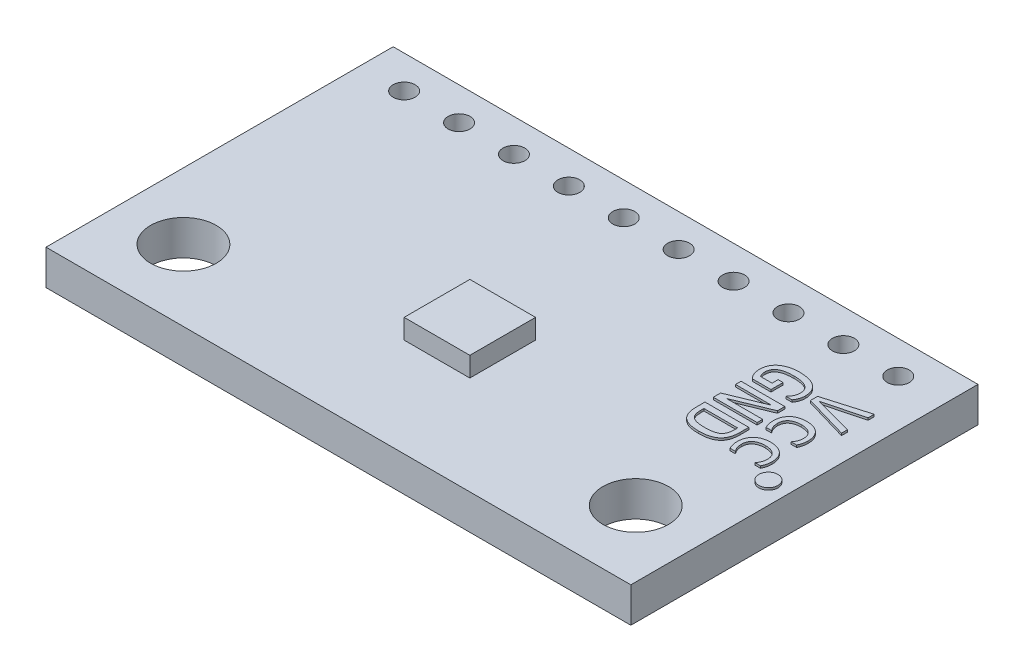
from build123d import *

# Parameters (mm, degrees)
SKETCH1_W                = 26.7
SKETCH1_H                = 15.85
FR4_BOARD_DEPTH          = 1.6
SKETCH2_W                = 3
SKETCH2_H                = 3
QFN_CHIP_DEPTH           = 0.9
SKETCH4_R                = 0.5
HEADER_CONNECTIONS_DEPTH = 16.725079491
SKETCH5_R                = 1.5
HOLES_MOUNTING_DEPTH     = 16.725079491
SKETCH6_R                = 0.436089782
BOSS_EXTRUDE1_DEPTH      = 0.1


with BuildPart() as part:
    # Sketch1 → FR4-board (new body)
    with BuildSketch(Plane(origin=(0, 0, 0), x_dir=(1, 0, 0), z_dir=(0, 1, 0))):
        Rectangle(SKETCH1_W, SKETCH1_H)
    extrude(amount=FR4_BOARD_DEPTH)

    # Sketch4 → header-connections (cut, through all)
    with BuildSketch(Plane(origin=(0, 0, 0), x_dir=(1, 0, 0), z_dir=(0, 1, 0))):
        with Locations(Location((-11.35, 6.425, 0), (0, 0, 270))):
            Circle(SKETCH4_R)
        with Locations(Location((-8.843333333, 6.425, 0), (0, 0, 270))):
            Circle(SKETCH4_R)
        with Locations(Location((-6.336666667, 6.425, 0), (0, 0, 270))):
            Circle(SKETCH4_R)
        with Locations(Location((-3.83, 6.425, 0), (0, 0, 270))):
            Circle(SKETCH4_R)
        with Locations(Location((-1.323333333, 6.425, 0), (0, 0, 270))):
            Circle(SKETCH4_R)
        with Locations(Location((1.183333333, 6.425, 0), (0, 0, 270))):
            Circle(SKETCH4_R)
        with Locations(Location((3.69, 6.425, 0), (0, 0, 270))):
            Circle(SKETCH4_R)
        with Locations(Location((6.196666667, 6.425, 0), (0, 0, 270))):
            Circle(SKETCH4_R)
        with Locations(Location((8.703333333, 6.425, 0), (0, 0, 270))):
            Circle(SKETCH4_R)
        with Locations(Location((11.21, 6.425, 0), (0, 0, 270))):
            Circle(SKETCH4_R)
    extrude(amount=HEADER_CONNECTIONS_DEPTH, mode=Mode.SUBTRACT)

    # Sketch5 → holes-mounting (cut, through all)
    with BuildSketch(Plane(origin=(0, 0, 0), x_dir=(1, 0, 0), z_dir=(0, 1, 0))):
        with Locations(Location((-10.325, -4.675, 0), (0, 0, 270))):
            Circle(SKETCH5_R)
        with Locations(Location((10.325, -4.675, 0), (0, 0, 90))):
            Circle(SKETCH5_R)
    extrude(amount=HOLES_MOUNTING_DEPTH, mode=Mode.SUBTRACT)

    # Sketch6 → Boss-Extrude1 (add)
    # profile 1 of 7: a face of its own
    with BuildSketch(Plane(origin=(0, 1.6, 0), x_dir=(1, 0, 0), z_dir=(0, 1, 0))):
        with Locations(Location((12.442186595, -0.735901507, 0), (0, 0, 270))):
            Circle(SKETCH6_R)
    # profile 2 of 7: a face of its own
    with BuildSketch(Plane(origin=(0, 1.6, 0), x_dir=(1, 0, 0), z_dir=(0, 1, 0))):
        Polygon((10.490449207, 3.528442684), (12.262601106, 3.059692684), (12.262601106, 2.780816102), (10.262601106, 3.364281291), (10.262601106, 3.691021798), (12.262601106, 4.274486988), (12.262601106, 3.995610405), align=None)
    # profile 3 of 7: a face of its own
    with BuildSketch(Plane(origin=(0, 1.6, 0), x_dir=(1, 0, 0), z_dir=(0, 1, 0))):
        with BuildLine():
            add(Edge.make_bspline(
                [(10.313234017, 1.287145215), (10.305112133, 1.30379608), (10.288947795, 1.33693497), (10.268576769, 1.388025137), (10.251000839, 1.439614148), (10.236760985, 1.491934519), (10.225646643, 1.545034576), (10.217809823, 1.598801119), (10.212862075, 1.653217788), (10.212267254, 1.689692734), (10.211968194, 1.708031291)],
                knots=[0, 0, 0, 0, 1.017318466, 2.024687874, 3.018716136, 4.009678849, 5.00117078, 5.996780967, 6.992838908, 8, 8, 8, 8], degree=3))
            add(Edge.make_bspline(
                [(10.211968194, 1.708031291), (10.21251301, 1.736410863), (10.21357576, 1.791769795), (10.223668945, 1.872415844), (10.240112487, 1.948370308), (10.263465919, 2.019434974), (10.293361241, 2.08577466), (10.329705343, 2.147427502), (10.373423175, 2.203876474), (10.422776044, 2.255845904), (10.478268449, 2.302136298), (10.539156063, 2.342381537), (10.605446355, 2.375887619), (10.676252131, 2.404254818), (10.75259147, 2.425410403), (10.833687105, 2.440757754), (10.919961275, 2.449898847), (10.979087323, 2.451090504), (11.009436549, 2.451702177)],
                knots=[0, 0, 0, 0, 1.101009695, 2.147696959, 3.148479169, 4.112976319, 5.045150305, 5.967552687, 6.883630536, 7.810239423, 8.743929232, 9.682109944, 10.636494221, 11.621942462, 12.63768542, 13.705575071, 14.822278422, 16, 16, 16, 16], degree=3))
            add(Edge.make_bspline(
                [(11.009436549, 2.451702177), (11.039785775, 2.451090504), (11.098911822, 2.449898847), (11.185185993, 2.440757754), (11.266281628, 2.425410403), (11.342620967, 2.404254818), (11.413426743, 2.375887619), (11.479717035, 2.342381537), (11.540604649, 2.302136298), (11.596097053, 2.255845904), (11.645449922, 2.203876474), (11.689167755, 2.147427502), (11.725511857, 2.08577466), (11.755407178, 2.019434974), (11.778760611, 1.948370308), (11.795204153, 1.872415844), (11.805297338, 1.791769795), (11.806360088, 1.736410863), (11.806904903, 1.708031291)],
                knots=[0, 0, 0, 0, 1.177721578, 2.294424929, 3.36231458, 4.378057538, 5.363505779, 6.317890056, 7.256070768, 8.189760577, 9.116369464, 10.032447313, 10.954849695, 11.887023681, 12.851520831, 13.852303041, 14.898990305, 16, 16, 16, 16], degree=3))
            add(Edge.make_bspline(
                [(11.806904903, 1.708031291), (11.806616762, 1.68995462), (11.806043687, 1.654002554), (11.800949129, 1.600549341), (11.793748621, 1.547626205), (11.782324194, 1.495435941), (11.768581001, 1.44317394), (11.751098199, 1.391005396), (11.730137752, 1.338737696), (11.713865088, 1.30446861), (11.705639081, 1.287145215)],
                knots=[0, 0, 0, 0, 0.992934621, 1.974813259, 2.948128798, 3.925694997, 4.90802788, 5.916044588, 6.946537941, 8, 8, 8, 8], degree=3))
            Line((11.705639081, 1.287145215), (11.452474524, 1.287145215))
            add(Edge.make_bspline(
                [(11.452474524, 1.287145215), (11.465123167, 1.303443423), (11.489885856, 1.335350993), (11.521809393, 1.385078866), (11.548351079, 1.434887316), (11.569107558, 1.485413828), (11.585358841, 1.537641458), (11.596103252, 1.592826948), (11.603021003, 1.651157647), (11.603915486, 1.691133089), (11.604373258, 1.711591418)],
                knots=[0, 0, 0, 0, 1.074217982, 2.103033978, 3.073910332, 4.010130881, 4.94433371, 5.918217984, 6.934601329, 8, 8, 8, 8], degree=3))
            add(Edge.make_bspline(
                [(11.604373258, 1.711591418), (11.603932837, 1.730598903), (11.60307623, 1.767568018), (11.595983693, 1.821442687), (11.583488118, 1.871814613), (11.567298159, 1.919222887), (11.545064161, 1.962727572), (11.518478065, 2.003132543), (11.486627582, 2.039854938), (11.450375121, 2.073429211), (11.409500517, 2.10295638), (11.364645445, 2.12887694), (11.315402654, 2.15012958), (11.262248448, 2.168013693), (11.204768163, 2.181693067), (11.143280918, 2.191464134), (11.077726763, 2.197494887), (11.032656723, 2.198183068), (11.009436549, 2.198537621)],
                knots=[0, 0, 0, 0, 1.044179997, 2.030905749, 2.978030625, 3.892303705, 4.776842266, 5.654948601, 6.543719924, 7.440955367, 8.36405586, 9.308516838, 10.281744973, 11.305850765, 12.386540981, 13.524023351, 14.72437194, 16, 16, 16, 16], degree=3))
            add(Edge.make_bspline(
                [(11.009436549, 2.198537621), (10.986348492, 2.19817763), (10.941410845, 2.197476959), (10.8761162, 2.191496668), (10.814761771, 2.181667015), (10.757451486, 2.167939204), (10.704033725, 2.150367436), (10.655159323, 2.127781903), (10.60977457, 2.102377611), (10.56892581, 2.072452484), (10.532215135, 2.039347862), (10.500852366, 2.002177051), (10.474135081, 1.961975707), (10.452178769, 1.918437295), (10.435179457, 1.871409576), (10.422942092, 1.821027871), (10.415800381, 1.767308619), (10.414940466, 1.730468537), (10.41449984, 1.711591418)],
                knots=[0, 0, 0, 0, 1.269431353, 2.470769189, 3.602031163, 4.683612011, 5.708561801, 6.68851158, 7.640043068, 8.563904318, 9.467220602, 10.352012893, 11.230842903, 12.116110441, 13.026759688, 13.974665121, 14.962204065, 16, 16, 16, 16], degree=3))
            add(Edge.make_bspline(
                [(10.41449984, 1.711591418), (10.414972203, 1.690477075), (10.415895791, 1.64919322), (10.422609913, 1.588958634), (10.434020455, 1.531999468), (10.450357394, 1.478237275), (10.471378113, 1.426924696), (10.498252765, 1.378316266), (10.529501008, 1.331111603), (10.553972466, 1.301951913), (10.566398574, 1.287145215)],
                knots=[0, 0, 0, 0, 1.097451232, 2.145793411, 3.14590378, 4.112960838, 5.062540776, 6.022576656, 6.995904645, 8, 8, 8, 8], degree=3))
            Line((10.566398574, 1.287145215), (10.313234017, 1.287145215))
        make_face()
    # profile 4 of 7: a face of its own
    with BuildSketch(Plane(origin=(0, 1.6, 0), x_dir=(1, 0, 0), z_dir=(0, 1, 0))):
        with BuildLine():
            add(Edge.make_bspline(
                [(10.313234017, -0.358424405), (10.305112133, -0.34177354), (10.288947795, -0.308634651), (10.268576769, -0.257544483), (10.251000839, -0.205955472), (10.236760985, -0.153635101), (10.225646643, -0.100535044), (10.217809823, -0.046768501), (10.212862075, 0.007648168), (10.212267254, 0.044123114), (10.211968194, 0.062461671)],
                knots=[0, 0, 0, 0, 1.017318466, 2.024687874, 3.018716136, 4.009678849, 5.00117078, 5.996780967, 6.992838908, 8, 8, 8, 8], degree=3))
            add(Edge.make_bspline(
                [(10.211968194, 0.062461671), (10.21251301, 0.090841243), (10.21357576, 0.146200175), (10.223668945, 0.226846224), (10.240112487, 0.302800688), (10.263465919, 0.373865354), (10.293361241, 0.44020504), (10.329705343, 0.501857882), (10.373423175, 0.558306854), (10.422776044, 0.610276283), (10.478268449, 0.656566678), (10.539156063, 0.696811917), (10.605446355, 0.730317999), (10.676252131, 0.758685198), (10.75259147, 0.779840783), (10.833687105, 0.795188134), (10.919961275, 0.804329226), (10.979087323, 0.805520883), (11.009436549, 0.806132557)],
                knots=[0, 0, 0, 0, 1.101009695, 2.147696959, 3.148479169, 4.112976319, 5.045150305, 5.967552687, 6.883630536, 7.810239423, 8.743929232, 9.682109944, 10.636494221, 11.621942462, 12.63768542, 13.705575071, 14.822278422, 16, 16, 16, 16], degree=3))
            add(Edge.make_bspline(
                [(11.009436549, 0.806132557), (11.039785775, 0.805520883), (11.098911822, 0.804329226), (11.185185993, 0.795188134), (11.266281628, 0.779840783), (11.342620967, 0.758685198), (11.413426743, 0.730317999), (11.479717035, 0.696811917), (11.540604649, 0.656566678), (11.596097053, 0.610276283), (11.645449922, 0.558306854), (11.689167755, 0.501857882), (11.725511857, 0.44020504), (11.755407178, 0.373865354), (11.778760611, 0.302800688), (11.795204153, 0.226846224), (11.805297338, 0.146200175), (11.806360088, 0.090841243), (11.806904903, 0.062461671)],
                knots=[0, 0, 0, 0, 1.177721578, 2.294424929, 3.36231458, 4.378057538, 5.363505779, 6.317890056, 7.256070768, 8.189760577, 9.116369464, 10.032447313, 10.954849695, 11.887023681, 12.851520831, 13.852303041, 14.898990305, 16, 16, 16, 16], degree=3))
            add(Edge.make_bspline(
                [(11.806904903, 0.062461671), (11.806616762, 0.044385), (11.806043687, 0.008432934), (11.800949129, -0.045020279), (11.793748621, -0.097943415), (11.782324194, -0.150133679), (11.768581001, -0.202395681), (11.751098199, -0.254564224), (11.730137752, -0.306831924), (11.713865088, -0.34110101), (11.705639081, -0.358424405)],
                knots=[0, 0, 0, 0, 0.992934621, 1.974813259, 2.948128798, 3.925694997, 4.90802788, 5.916044588, 6.946537941, 8, 8, 8, 8], degree=3))
            Line((11.705639081, -0.358424405), (11.452474524, -0.358424405))
            add(Edge.make_bspline(
                [(11.452474524, -0.358424405), (11.465123167, -0.342126197), (11.489885856, -0.310218627), (11.521809393, -0.260490754), (11.548351079, -0.210682304), (11.569107558, -0.160155792), (11.585358841, -0.107928162), (11.596103252, -0.052742673), (11.603021003, 0.005588027), (11.603915486, 0.045563468), (11.604373258, 0.066021798)],
                knots=[0, 0, 0, 0, 1.074217982, 2.103033978, 3.073910332, 4.010130881, 4.94433371, 5.918217984, 6.934601329, 8, 8, 8, 8], degree=3))
            add(Edge.make_bspline(
                [(11.604373258, 0.066021798), (11.603932837, 0.085029283), (11.60307623, 0.121998398), (11.595983693, 0.175873067), (11.583488118, 0.226244993), (11.567298159, 0.273653267), (11.545064161, 0.317157952), (11.518478065, 0.357562923), (11.486627582, 0.394285318), (11.450375121, 0.427859591), (11.409500517, 0.45738676), (11.364645445, 0.48330732), (11.315402654, 0.50455996), (11.262248448, 0.522444073), (11.204768163, 0.536123447), (11.143280918, 0.545894513), (11.077726763, 0.551925266), (11.032656723, 0.552613448), (11.009436549, 0.552968)],
                knots=[0, 0, 0, 0, 1.044179997, 2.030905749, 2.978030625, 3.892303705, 4.776842266, 5.654948601, 6.543719924, 7.440955367, 8.36405586, 9.308516838, 10.281744973, 11.305850765, 12.386540981, 13.524023351, 14.72437194, 16, 16, 16, 16], degree=3))
            add(Edge.make_bspline(
                [(11.009436549, 0.552968), (10.986348492, 0.55260801), (10.941410845, 0.551907339), (10.8761162, 0.545927047), (10.814761771, 0.536097395), (10.757451486, 0.522369583), (10.704033725, 0.504797816), (10.655159323, 0.482212283), (10.60977457, 0.456807991), (10.56892581, 0.426882864), (10.532215135, 0.393778242), (10.500852366, 0.35660743), (10.474135081, 0.316406087), (10.452178769, 0.272867674), (10.435179457, 0.225839956), (10.422942092, 0.175458251), (10.415800381, 0.121738999), (10.414940466, 0.084898917), (10.41449984, 0.066021798)],
                knots=[0, 0, 0, 0, 1.269431353, 2.470769189, 3.602031163, 4.683612011, 5.708561801, 6.68851158, 7.640043068, 8.563904318, 9.467220602, 10.352012893, 11.230842903, 12.116110441, 13.026759688, 13.974665121, 14.962204065, 16, 16, 16, 16], degree=3))
            add(Edge.make_bspline(
                [(10.41449984, 0.066021798), (10.414972203, 0.044907455), (10.415895791, 0.0036236), (10.422609913, -0.056610986), (10.434020455, -0.113570152), (10.450357394, -0.167332345), (10.471378113, -0.218644924), (10.498252765, -0.267253354), (10.529501008, -0.314458017), (10.553972466, -0.343617707), (10.566398574, -0.358424405)],
                knots=[0, 0, 0, 0, 1.097451232, 2.145793411, 3.14590378, 4.112960838, 5.062540776, 6.022576656, 6.995904645, 8, 8, 8, 8], degree=3))
            Line((10.566398574, -0.358424405), (10.313234017, -0.358424405))
        make_face()
    # profile 5 of 7: a face of its own
    with BuildSketch(Plane(origin=(0, 1.6, 0), x_dir=(1, 0, 0), z_dir=(0, 1, 0))):
        with BuildLine():
            add(Edge.make_bspline(
                [(8.076807306, 2.894049356), (8.060035504, 2.912293324), (8.026805949, 2.948439645), (7.98458451, 3.008552789), (7.947998102, 3.071473377), (7.917664474, 3.137903752), (7.894431539, 3.207568895), (7.877904083, 3.280176744), (7.867131258, 3.35535579), (7.866096411, 3.406538492), (7.865573129, 3.432419609)],
                knots=[0, 0, 0, 0, 1.001737365, 1.98471738, 2.964739576, 3.943599402, 4.93390658, 5.930388061, 6.953477121, 8, 8, 8, 8], degree=3))
            add(Edge.make_bspline(
                [(7.865573129, 3.432419609), (7.866345829, 3.463326778), (7.867852317, 3.523584641), (7.881412618, 3.611184217), (7.902380845, 3.693794833), (7.933148457, 3.770857569), (7.972121373, 3.842849556), (8.020095874, 3.909191221), (8.076187435, 3.970755863), (8.14142408, 4.0258532), (8.214058731, 4.075437316), (8.293886326, 4.118552398), (8.380663184, 4.155069425), (8.474389634, 4.184443166), (8.574859378, 4.207876576), (8.682251108, 4.22415307), (8.796549567, 4.234235552), (8.875044838, 4.235282872), (8.915414901, 4.235821508)],
                knots=[0, 0, 0, 0, 0.992063724, 1.934167464, 2.840131843, 3.724052428, 4.591992448, 5.462872006, 6.347117166, 7.260288322, 8.198815907, 9.167139437, 10.169195144, 11.217889675, 12.318070579, 13.47943294, 14.703674141, 16, 16, 16, 16], degree=3))
            add(Edge.make_bspline(
                [(8.915414901, 4.235821508), (8.955656115, 4.235322816), (9.034037002, 4.234351475), (9.148042434, 4.223693083), (9.255404447, 4.207349134), (9.355916532, 4.184340875), (9.449475528, 4.153951389), (9.536591741, 4.117993007), (9.616426586, 4.074085315), (9.689443768, 4.024312705), (9.754880331, 3.968764252), (9.811685251, 3.907220288), (9.859687222, 3.840504351), (9.899486706, 3.768705835), (9.92937028, 3.691241026), (9.951178393, 3.60889975), (9.964489863, 3.521326864), (9.96604365, 3.461211605), (9.966838952, 3.430441761)],
                knots=[0, 0, 0, 0, 1.290702506, 2.513999905, 3.669932732, 4.773050416, 5.817879969, 6.822756618, 7.7920623, 8.735460261, 9.653613319, 10.539769518, 11.415616797, 12.284653946, 13.16607185, 14.072138772, 15.0132291, 16, 16, 16, 16], degree=3))
            add(Edge.make_bspline(
                [(9.966838952, 3.430441761), (9.966401265, 3.40984915), (9.965531666, 3.368935677), (9.957986421, 3.30827622), (9.946807045, 3.248646176), (9.930037686, 3.19046592), (9.908472956, 3.133510354), (9.882290769, 3.077714978), (9.851426678, 3.022682457), (9.82723052, 2.987745006), (9.814940218, 2.969998723)],
                knots=[0, 0, 0, 0, 1.001924427, 1.99062708, 2.971130492, 3.952305798, 4.933313174, 5.932458846, 6.94980405, 8, 8, 8, 8], degree=3))
            Line((9.814940218, 2.969998723), (9.536459205, 2.969998723))
            add(Edge.make_bspline(
                [(9.536459205, 2.969998723), (9.553041141, 2.98775578), (9.585384166, 3.022390877), (9.626559631, 3.078096426), (9.662106391, 3.133711676), (9.690284514, 3.19067516), (9.712254488, 3.24868939), (9.727829321, 3.308202599), (9.737094856, 3.369363223), (9.738355513, 3.410763731), (9.73899085, 3.43162847)],
                knots=[0, 0, 0, 0, 1.126014533, 2.196288612, 3.20760718, 4.184038892, 5.13820979, 6.080170111, 7.032457543, 8, 8, 8, 8], degree=3))
            add(Edge.make_bspline(
                [(9.73899085, 3.43162847), (9.738405509, 3.452891389), (9.737264978, 3.494321986), (9.727763362, 3.554427529), (9.711416671, 3.610338676), (9.68887689, 3.66218404), (9.659607119, 3.709757139), (9.624041196, 3.753341244), (9.581792027, 3.792629659), (9.53297643, 3.827505894), (9.478104829, 3.858458297), (9.41662012, 3.884890067), (9.348802634, 3.907239265), (9.274651044, 3.925821998), (9.193977111, 3.939832758), (9.106944635, 3.949903954), (9.013351397, 3.956419149), (8.948786054, 3.957026553), (8.915414901, 3.957340495)],
                knots=[0, 0, 0, 0, 0.922937467, 1.798334972, 2.6335666, 3.446280457, 4.245593382, 5.05127869, 5.881708287, 6.742967739, 7.650558106, 8.612112746, 9.64412718, 10.74808868, 11.928493369, 13.196862007, 14.551173997, 16, 16, 16, 16], degree=3))
            add(Edge.make_bspline(
                [(8.915414901, 3.957340495), (8.881651278, 3.956982306), (8.816310148, 3.95628912), (8.721646276, 3.950375241), (8.63375387, 3.940451903), (8.552481954, 3.927556229), (8.47820687, 3.909418835), (8.41028377, 3.888682857), (8.349542859, 3.862675867), (8.295018501, 3.833686662), (8.247616999, 3.799562076), (8.205836083, 3.762105471), (8.171313547, 3.719500914), (8.142250318, 3.673389848), (8.120605781, 3.622389964), (8.104778778, 3.567562522), (8.095090967, 3.508445379), (8.093988823, 3.467662756), (8.09342123, 3.446660116)],
                knots=[0, 0, 0, 0, 1.478225482, 2.860739251, 4.150494589, 5.350171355, 6.46058182, 7.495856668, 8.45556613, 9.349427223, 10.193699797, 11.006904119, 11.798593043, 12.586801071, 13.385802657, 14.215299668, 15.080897288, 16, 16, 16, 16], degree=3))
            add(Edge.make_bspline(
                [(8.09342123, 3.446660116), (8.093586982, 3.432407595), (8.093906913, 3.40489759), (8.098129897, 3.364875295), (8.104199905, 3.327549151), (8.113011234, 3.29260249), (8.124317624, 3.259851133), (8.139457046, 3.229344846), (8.156114812, 3.199660186), (8.169935206, 3.181609356), (8.17688642, 3.172530369)],
                knots=[0, 0, 0, 0, 1.169255542, 2.256879789, 3.299474652, 4.270648645, 5.211936945, 6.136465062, 7.062701813, 8, 8, 8, 8], degree=3))
            Line((8.17688642, 3.172530369), (8.701016167, 3.172530369))
            Line((8.701016167, 3.172530369), (8.701016167, 3.451011381))
            Line((8.701016167, 3.451011381), (8.928864268, 3.451011381))
            Line((8.928864268, 3.451011381), (8.928864268, 2.894049356))
            Line((8.928864268, 2.894049356), (8.076807306, 2.894049356))
        make_face()
    # profile 6 of 7: a face of its own
    with BuildSketch(Plane(origin=(0, 1.6, 0), x_dir=(1, 0, 0), z_dir=(0, 1, 0))):
        Polygon((9.91620604, 2.539618976), (9.91620604, 2.204571508), (8.269845281, 1.526960748), (9.91620604, 1.526960748), (9.91620604, 1.273796191), (7.91620604, 1.273796191), (7.91620604, 1.60884366), (9.5625668, 2.286454419), (7.91620604, 2.286454419), (7.91620604, 2.539618976), align=None)
    # profile 7 of 7: a face of its own
    with BuildSketch(Plane(origin=(0, 1.6, 0), x_dir=(1, 0, 0), z_dir=(0, 1, 0))):
        with BuildLine():
            add(Edge.make_bspline(
                [(9.91620604, 0.482656951), (9.915471626, 0.446232188), (9.914049465, 0.375697295), (9.902412303, 0.273541861), (9.883701925, 0.178692157), (9.857398919, 0.091025764), (9.82286516, 0.010984672), (9.780792908, -0.061654478), (9.730881323, -0.126879439), (9.67300163, -0.184706972), (9.606964589, -0.235334826), (9.532766219, -0.278944256), (9.450213625, -0.315797431), (9.359227911, -0.345617875), (9.259817499, -0.368895043), (9.151991406, -0.384995075), (9.035882232, -0.395664276), (8.955656666, -0.396604403), (8.914228192, -0.397089884)],
                knots=[0, 0, 0, 0, 1.138439572, 2.204536338, 3.209384919, 4.157363895, 5.060183305, 5.928367343, 6.775090383, 7.620367337, 8.478650543, 9.369400619, 10.304830437, 11.299413225, 12.358241365, 13.492733824, 14.70524802, 16, 16, 16, 16], degree=3))
            add(Edge.make_bspline(
                [(8.914228192, -0.397089884), (8.872931908, -0.396601973), (8.792970225, -0.395657233), (8.67737988, -0.385035834), (8.57009478, -0.368846365), (8.471195539, -0.345636251), (8.380509598, -0.315718695), (8.29807122, -0.278936684), (8.223920079, -0.235439942), (8.158192526, -0.184704662), (8.100757643, -0.126740481), (8.050783441, -0.06176837), (8.009119106, 0.011008474), (7.975194925, 0.091184381), (7.948186567, 0.178604398), (7.929524705, 0.273528557), (7.918492622, 0.3757235), (7.916984834, 0.446236162), (7.91620604, 0.482656951)],
                knots=[0, 0, 0, 0, 1.293331948, 2.504268906, 3.632971402, 4.689995351, 5.682739763, 6.62012701, 7.512741021, 8.369550572, 9.213680511, 10.062175357, 10.930104547, 11.833180293, 12.784354582, 13.791305853, 14.859178193, 16, 16, 16, 16], degree=3))
            Line((7.91620604, 0.482656951), (7.91620604, 0.894049356))
            Line((7.91620604, 0.894049356), (9.91620604, 0.894049356))
            Line((9.91620604, 0.894049356), (9.91620604, 0.482656951))
        make_face()
        with BuildLine():
            add(Edge.make_bspline(
                [(8.144054142, 0.488194926), (8.144622152, 0.461016373), (8.145716366, 0.40865973), (8.153000901, 0.333339067), (8.165916887, 0.264293011), (8.184432467, 0.201748703), (8.207706196, 0.145327783), (8.236233958, 0.095199691), (8.270578809, 0.051683753), (8.310501909, 0.013932498), (8.357819478, -0.017839403), (8.412790569, -0.044760671), (8.475761265, -0.068324687), (8.547480776, -0.086386656), (8.627324431, -0.100810845), (8.71554813, -0.111394943), (8.812079062, -0.117667987), (8.879276352, -0.118286934), (8.914228192, -0.118608872)],
                knots=[0, 0, 0, 0, 1.138112724, 2.192455326, 3.164921185, 4.075119992, 4.919081184, 5.715594558, 6.482226996, 7.232234576, 8.007173561, 8.859098948, 9.790357849, 10.817574363, 11.951500368, 13.186335339, 14.53650706, 16, 16, 16, 16], degree=3))
            add(Edge.make_bspline(
                [(8.914228192, -0.118608872), (8.949445455, -0.118303735), (9.017172943, -0.117716917), (9.11458521, -0.11120897), (9.2035331, -0.101383769), (9.283949943, -0.086889599), (9.355806524, -0.06803017), (9.419396984, -0.045348746), (9.474675639, -0.018654069), (9.521904064, 0.013154393), (9.561826302, 0.050892521), (9.596213714, 0.094395196), (9.624586709, 0.144638662), (9.648596637, 0.200782769), (9.666376239, 0.263718145), (9.679420285, 0.332802958), (9.686702997, 0.408398739), (9.687791551, 0.460885472), (9.688357939, 0.488194926)],
                knots=[0, 0, 0, 0, 1.468829813, 2.824755365, 4.070551547, 5.200090802, 6.230052328, 7.166133154, 8.012317254, 8.78425828, 9.531364352, 10.295030965, 11.088462916, 11.931297553, 12.83642224, 13.810529379, 14.86079311, 16, 16, 16, 16], degree=3))
            Line((9.688357939, 0.488194926), (9.688357939, 0.615568343))
            Line((9.688357939, 0.615568343), (8.144054142, 0.615568343))
            Line((8.144054142, 0.615568343), (8.144054142, 0.488194926))
        make_face(mode=Mode.SUBTRACT)
    extrude(amount=BOSS_EXTRUDE1_DEPTH)


with BuildPart() as body_2:
    # Sketch2 → QFN-chip (new body)
    with BuildSketch(Plane(origin=(0, 1.6, 0), x_dir=(1, 0, 0), z_dir=(0, 1, 0))):
        with Locations((0, -1.925)):
            Rectangle(SKETCH2_W, SKETCH2_H)
    extrude(amount=QFN_CHIP_DEPTH)


solid = Compound([part.part, body_2.part])
